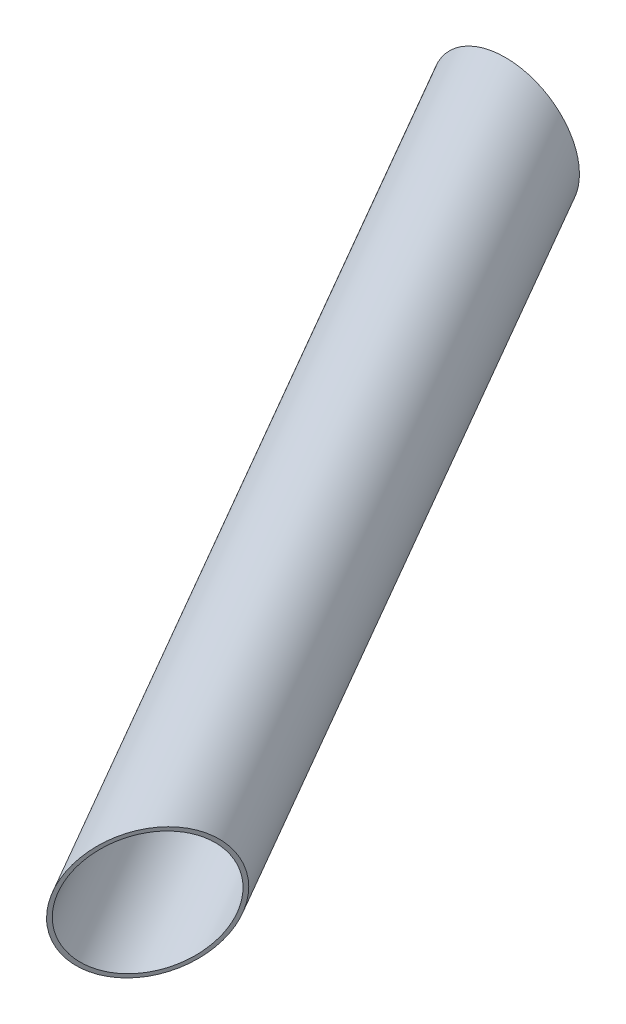
from build123d import *

# Parameters (mm, degrees)
SKETCH3_R              = 53
SKETCH3_R_2            = 50
SPLIT1_SURFACE_1_BACK  = 2303.894
SPLIT1_SURFACE_1_DEPTH = 4607.788


with BuildPart() as part:
    # Sweep1: sweep along a path in Sketch2
    with BuildLine(Plane(origin=(0, 0, 0), x_dir=(1, 0, 0), z_dir=(0, 1, 0))) as sweep1_path:
        Line((-404.145188433, -700), (404.145188433, -700))
        Line((404.145188433, -700), (808.290376865, 0))
        Line((808.290376865, 0), (404.145188433, 700))
        Line((404.145188433, 700), (-404.145188433, 700))
        Line((-404.145188433, 700), (-808.290376865, 0))
        Line((-808.290376865, 0), (-404.145188433, -700))
    # Sketch3 → Sweep1 (sweep)
    with BuildSketch(Plane(origin=(0, 0, 0), x_dir=(0, 0, -1), z_dir=(1, 0, 0))):
        with Locations((-700, 0)):
            Circle(SKETCH3_R)
        with Locations((-700, 0)):
            Circle(SKETCH3_R_2, mode=Mode.SUBTRACT)
    sweep(path=sweep1_path.line, transition=Transition.RIGHT)

    # Split1: cut with a surface, the side it looks to stays
    # Split1 surface: a surface, the sketch's curves swept straight by 4607.788 mm
    with BuildLine(Plane(origin=(0, 0, 0), x_dir=(1, 0, 0), z_dir=(0, 1, 0)).offset(-SPLIT1_SURFACE_1_BACK), mode=Mode.PRIVATE) as split1_surface_1_path:
        Line((-492.250288532, -852.602509777), (0, 0))
        Line((0, 0), (-984.500577063, 0))
    split1_surface_1 = Shell.extrude(split1_surface_1_path.wire(), (0 * SPLIT1_SURFACE_1_DEPTH, 1 * SPLIT1_SURFACE_1_DEPTH, 0 * SPLIT1_SURFACE_1_DEPTH))
    split(bisect_by=split1_surface_1, keep=Keep.TOP)


solid = part.part
